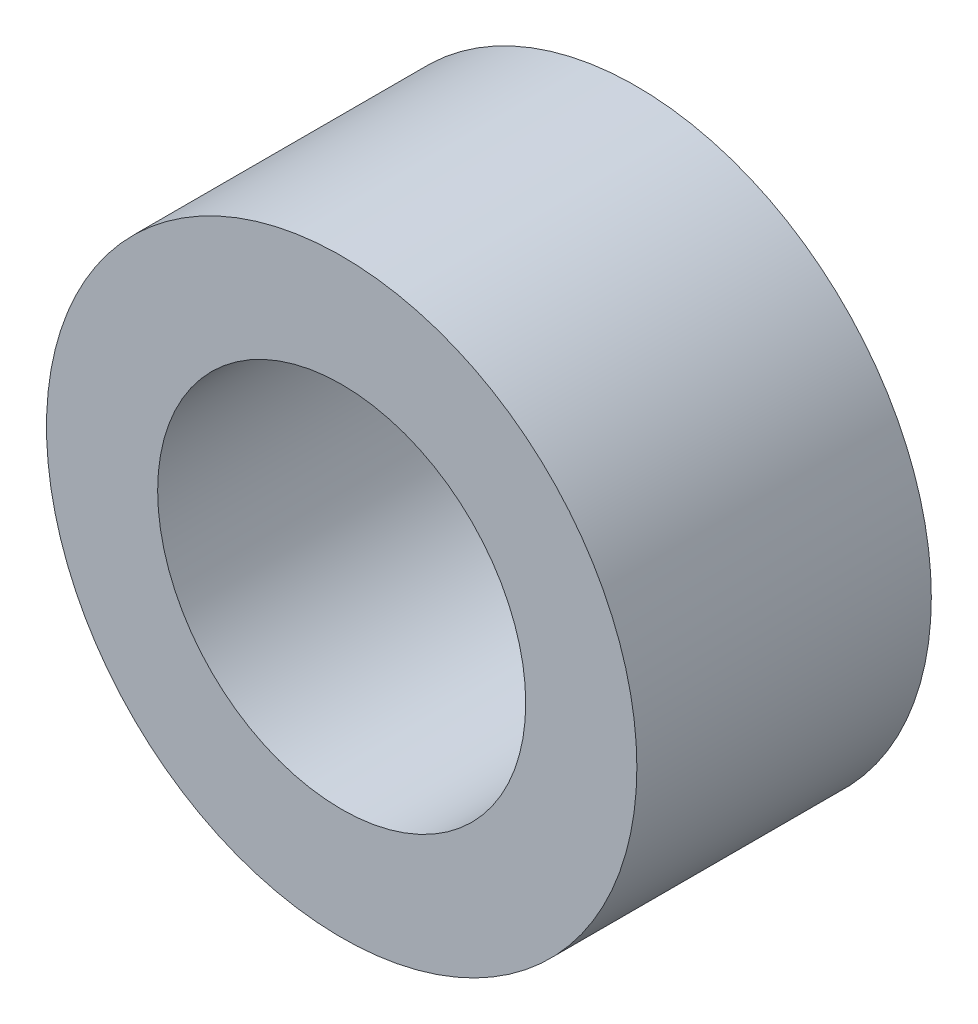
from build123d import *

# Parameters (mm, degrees)
SKETCH1_R      = 4.01
SKETCH1_R_2    = 2.5
EXTRUDE1_DEPTH = 2


with BuildPart() as part:
    # Sketch1 → Extrude1 (new, symmetric)
    with BuildSketch(Plane.XY):
        Circle(SKETCH1_R)
        Circle(SKETCH1_R_2, mode=Mode.SUBTRACT)
    extrude(amount=EXTRUDE1_DEPTH, both=True)


solid = part.part
